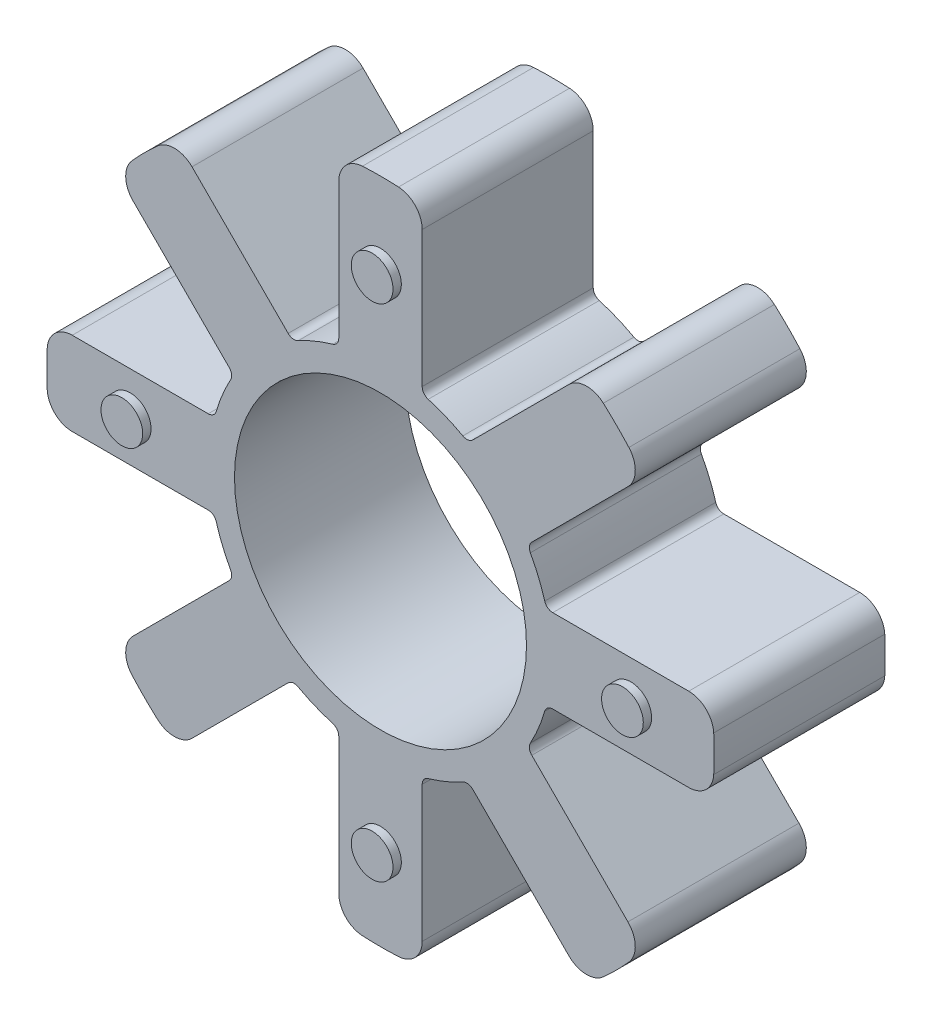
from build123d import *

# Parameters (mm, degrees)
SKETCH1_R                = 20.5
SKETCH1_R_2              = 17.5
BOSS_EXTRUDE1_DEPTH      = 20.5
BOSS_EXTRUDE2_START      = -20.5
BOSS_EXTRUDE2_DEPTH      = 20.5
FILLET1_R                = 3
FILLET2_R                = 1
CIRPATTERN1_COUNT        = 8
FILLET1_OF_CIRPATTERN1_R = 3
FILLET2_OF_CIRPATTERN1_R = 1
SKETCH5_R                = 2.5
BOSS_EXTRUDE3_DEPTH      = 1
SKETCH6_R                = 2.5
BOSS_EXTRUDE4_DEPTH      = 1
CIRPATTERN2_COUNT        = 4


with BuildPart() as part:
    # Sketch1 → Boss-Extrude1 (new body)
    with BuildSketch(Plane.XY):
        Circle(SKETCH1_R)
        Circle(SKETCH1_R_2, mode=Mode.SUBTRACT)
    extrude(amount=BOSS_EXTRUDE1_DEPTH)

    # Sketch4 → Boss-Extrude2 (add)
    with BuildSketch(Plane.XY.offset(20.5).offset(BOSS_EXTRUDE2_START)):
        with BuildLine():
            Line((-5, 39.686269666), (-5, 19.880895352))
            ThreePointArc((-5, 19.880895352), (0, 20.5), (5, 19.880895352))
            Line((5, 19.880895352), (5, 39.686269666))
            ThreePointArc((5, 39.686269666), (0, 40), (-5, 39.686269666))
        make_face()
    boss_extrude2 = extrude(amount=BOSS_EXTRUDE2_DEPTH)

    # Fillet1
    fillet1_edges = [part.edges().sort_by_distance(p)[0] for p in [
        (5, 39.686269666, 10.25),
        (-5, 39.686269666, 10.25),
    ]]
    fillet(fillet1_edges, radius=FILLET1_R)

    # Fillet2
    fillet2_edges = [part.edges().sort_by_distance(p)[0] for p in [
        (5, 19.880895352, 10.25),
        (-5, 19.880895352, 10.25),
    ]]
    fillet(fillet2_edges, radius=FILLET2_R)

    # CirPattern1: Boss-Extrude2 ×8 about axis
    cirpattern1_axis = Axis((0, 0, 0), (0, 0, 1))
    for i in range(1, CIRPATTERN1_COUNT):
        add(boss_extrude2.rotate(cirpattern1_axis, i * 360 / CIRPATTERN1_COUNT))

    # Fillet1 of CirPattern1
    fillet1_of_cirpattern1_edges = [part.edges().sort_by_distance(p)[0] for p in [
        (-24.526896495, 31.597964307, 10.25),
        (-31.597964307, 24.526896495, 10.25),
        (-39.686269666, 5, 10.25),
        (-39.686269666, -5, 10.25),
        (-31.597964307, -24.526896495, 10.25),
        (-24.526896495, -31.597964307, 10.25),
        (-5, -39.686269666, 10.25),
        (5, -39.686269666, 10.25),
        (24.526896495, -31.597964307, 10.25),
        (31.597964307, -24.526896495, 10.25),
        (39.686269666, -5, 10.25),
        (39.686269666, 5, 10.25),
        (31.597964307, 24.526896495, 10.25),
        (24.526896495, 31.597964307, 10.25),
    ]]
    fillet(fillet1_of_cirpattern1_edges, radius=FILLET1_OF_CIRPATTERN1_R)

    # Fillet2 of CirPattern1
    fillet2_of_cirpattern1_edges = [part.edges().sort_by_distance(p)[0] for p in [
        (-10.522382014, 17.593449825, 10.25),
        (-17.593449825, 10.522382014, 10.25),
        (-19.880895352, 5, 10.25),
        (-19.880895352, -5, 10.25),
        (-17.593449825, -10.522382014, 10.25),
        (-10.522382014, -17.593449825, 10.25),
        (-5, -19.880895352, 10.25),
        (5, -19.880895352, 10.25),
        (10.522382014, -17.593449825, 10.25),
        (17.593449825, -10.522382014, 10.25),
        (19.880895352, -5, 10.25),
        (19.880895352, 5, 10.25),
        (17.593449825, 10.522382014, 10.25),
        (10.522382014, 17.593449825, 10.25),
    ]]
    fillet(fillet2_of_cirpattern1_edges, radius=FILLET2_OF_CIRPATTERN1_R)

    # Sketch5 → Boss-Extrude3 (add)
    with BuildSketch(Plane.XY.offset(20.5)):
        with Locations((0, 30)):
            Circle(SKETCH5_R)
    boss_extrude3 = extrude(amount=BOSS_EXTRUDE3_DEPTH)

    # Sketch6 → Boss-Extrude4 (add)
    with BuildSketch(Plane(origin=(0, 0, 0), x_dir=(-1, 0, 0), z_dir=(0, 0, -1))):
        with Locations(Location((-21.213203436, 21.213203436, 0), (0, 0, 180))):
            Circle(SKETCH6_R)
    boss_extrude4 = extrude(amount=BOSS_EXTRUDE4_DEPTH)

    # CirPattern2: Boss-Extrude3, Boss-Extrude4 ×4 about axis
    cirpattern2_axis = Axis((0, 0, 0), (0, 0, 1))
    add([boss_extrude3.rotate(cirpattern2_axis, i * 360 / CIRPATTERN2_COUNT) for i in range(1, CIRPATTERN2_COUNT)])
    add([boss_extrude4.rotate(cirpattern2_axis, i * 360 / CIRPATTERN2_COUNT) for i in range(1, CIRPATTERN2_COUNT)])


solid = part.part
